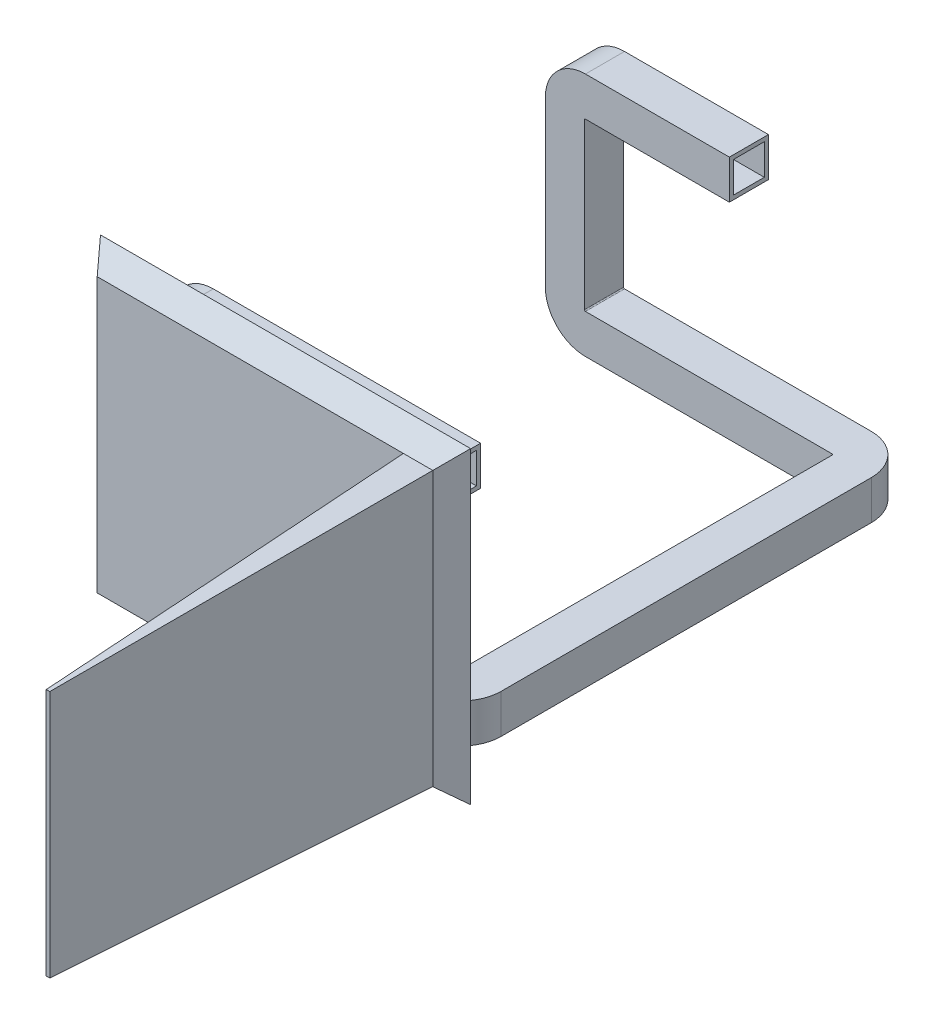
from build123d import *

# Parameters (mm, degrees)
SKETCH2_W           = 19
SKETCH2_H           = 19
SKETCH2_W_2         = 15
SKETCH2_H_2         = 15
SKETCH3_W           = 180
SKETCH3_H           = 150
BOSS_EXTRUDE1_DEPTH = 10
BOSS_EXTRUDE1_TAPER = 40
SKETCH4_W           = 14.282717188
SKETCH4_H           = 133.218007376
BOSS_EXTRUDE2_DEPTH = 180
BOSS_EXTRUDE2_TAPER = 2


with BuildPart() as part:
    # Sweep-Thin1: sweep along a curve in space
    with BuildLine() as sweep_thin1_path:
        Line((0, 0, 0), (-70, 0, 0))
        ThreePointArc((-70, 0, 0), (-77.071067812, -2.928932188, 0), (-80, -10, 0))
        Line((-80, -10, 0), (-80, -90, 0))
        ThreePointArc((-80, -90, 0), (-77.071067812, -97.071067812, 0), (-70, -100, 0))
        Line((-70, -100, 0), (50, -100, 0))
        ThreePointArc((50, -100, 0), (57.071067812, -100, 2.928932188), (60, -100, 10))
        Line((60, -100, 10), (60, -100, 190))
        ThreePointArc((60, -100, 190), (57.071067812, -100, 197.071067812), (50, -100, 200))
        Line((50, -100, 200), (-70, -100, 200))
        ThreePointArc((-70, -100, 200), (-77.071067812, -97.071067812, 200), (-80, -90, 200))
        Line((-80, -90, 200), (-80, -10, 200))
        ThreePointArc((-80, -10, 200), (-77.071067812, -2.928932188, 200), (-70, 0, 200))
        Line((-70, 0, 200), (60, 0, 200))
    # Sketch2 → Sweep-Thin1 (sweep)
    with BuildSketch(Plane(origin=(0, 0, 0), x_dir=(0, 0, -1), z_dir=(1, 0, 0))):
        Rectangle(SKETCH2_W, SKETCH2_H)
        Rectangle(SKETCH2_W_2, SKETCH2_H_2, mode=Mode.SUBTRACT)
    sweep(path=sweep_thin1_path.line)

    # Sketch3 → Boss-Extrude1 (add)
    with BuildSketch(Plane.XY.offset(209.5)):
        with Locations((-15.849049542, -51.188068464)):
            Rectangle(SKETCH3_W, SKETCH3_H)
    extrude(amount=BOSS_EXTRUDE1_DEPTH, taper=BOSS_EXTRUDE1_TAPER)

    # Sketch4 → Boss-Extrude2 (add)
    with BuildSketch(Plane.XY.offset(219.5)):
        with Locations((58.618595553, -51.188068464)):
            Rectangle(SKETCH4_W, SKETCH4_H)
    extrude(amount=BOSS_EXTRUDE2_DEPTH, taper=BOSS_EXTRUDE2_TAPER)


solid = part.part
